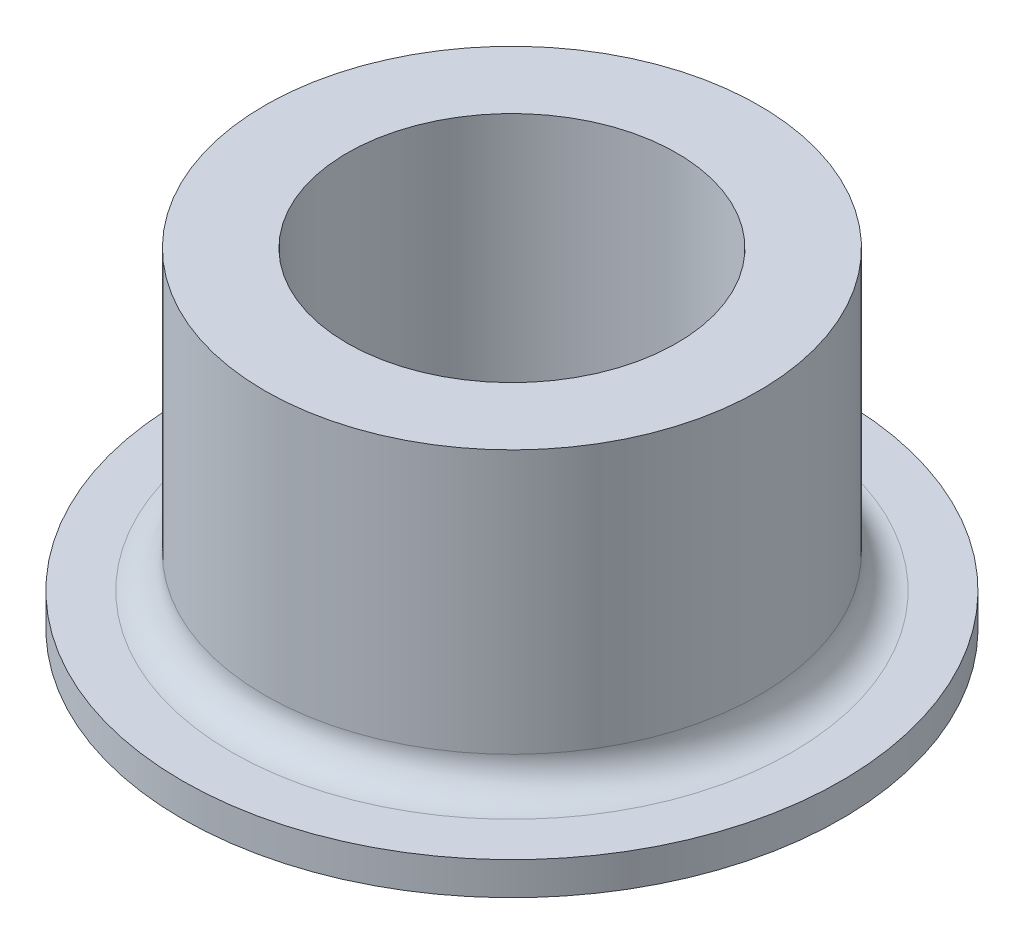
from build123d import *

# Parameters (mm, degrees)
SKETCH1_R           = 10
SKETCH1_R_2         = 7.5
BOSS_EXTRUDE1_DEPTH = 1
SKETCH1_3_R         = 7.5
SKETCH1_3_R_2       = 5
BOSS_EXTRUDE2_DEPTH = 10
FILLET1_R           = 1


with BuildPart() as part:
    # Sketch1 → Boss-Extrude1 (new body)
    with BuildSketch(Plane(origin=(0, 0, 0), x_dir=(-1, 0, 0), z_dir=(0, 1, 0))):
        Circle(SKETCH1_R)
        Circle(SKETCH1_R_2, mode=Mode.SUBTRACT)
    extrude(amount=BOSS_EXTRUDE1_DEPTH)

    # Sketch1<3> → Boss-Extrude2 (add)
    with BuildSketch(Plane(origin=(0, 0, 0), x_dir=(-1, 0, 0), z_dir=(0, 1, 0))):
        Circle(SKETCH1_3_R)
        Circle(SKETCH1_3_R_2, mode=Mode.SUBTRACT)
    extrude(amount=BOSS_EXTRUDE2_DEPTH)

    # Fillet1
    fillet1_edges = [part.edges().sort_by_distance(p)[0] for p in [
        (7.5, 1, 0),
    ]]
    fillet(fillet1_edges, radius=FILLET1_R)


solid = part.part
